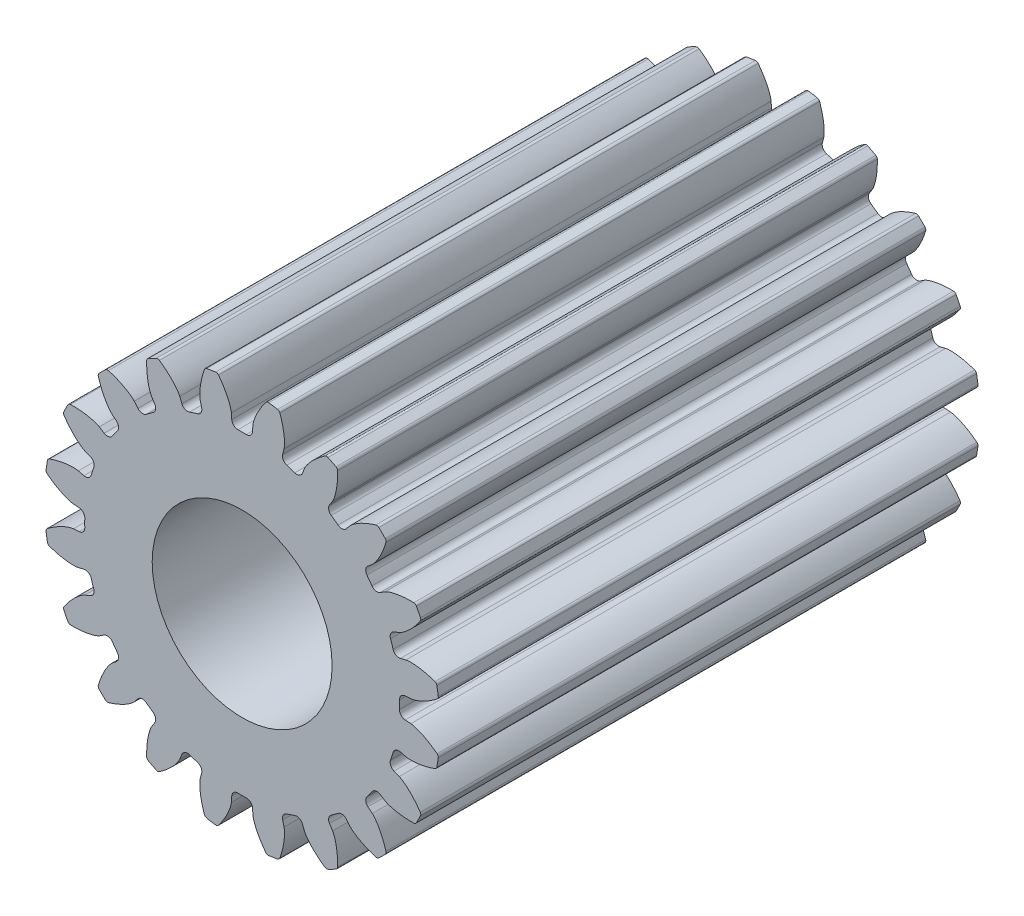
from build123d import *

# Parameters (mm, degrees)
SKETCH1_R                                 = 5.5
BOSS_EXTRUDE1_DEPTH                       = 15
CUT_EXTRUDE_DCLTBC_DEPTH                  = 17.896745249
FILLET_TIP_DCLTBC_R                       = 0.083876259
FILLET_ROOT_DCLTBC_R                      = 0.167752518
CIRPATTERN_DCLTBC_COUNT                   = 20
FILLET_TIP_DCLTBC_OF_CIRPATTERN_DCLTBC_R  = 0.083876259
FILLET_ROOT_DCLTBC_OF_CIRPATTERN_DCLTBC_R = 0.167752518
SKETCH4_R                                 = 2.5
CUT_EXTRUDE2_DEPTH                        = 17.865121555


with BuildPart() as part:
    # Sketch1 → Boss-Extrude1 (new body)
    with BuildSketch(Plane.XY):
        Circle(SKETCH1_R)
    extrude(amount=BOSS_EXTRUDE1_DEPTH)

    # DCLTBC → Cut-Extrude-DCLTBC (cut, through all)
    with BuildSketch(Plane.XY):
        with BuildLine():
            Line((-0.298786982, 4.688953175), (-0.278217156, 4.366144777))
            ThreePointArc((-0.278217156, 4.366144777), (0, 4.375), (0.278217156, 4.366144777))
            Line((0.278217156, 4.366144777), (0.298786982, 4.688953175))
            add(Edge.make_bspline(
                [(0.298786982, 4.688953175), (0.298885303, 4.690235768), (0.299212216, 4.693829281), (0.300032178, 4.700607016), (0.301656509, 4.711638976), (0.304146629, 4.725650974), (0.307847067, 4.743703274), (0.312824999, 4.764886928), (0.318942425, 4.788072131), (0.32629422, 4.813184764), (0.334243016, 4.838132069), (0.342742582, 4.862912541), (0.351722862, 4.887497966), (0.363205633, 4.917153446), (0.377814175, 4.952534177), (0.396106934, 4.993608657), (0.418286495, 5.039847917), (0.442414202, 5.086578132), (0.467404569, 5.132227021), (0.49407968, 5.177940439), (0.520898914, 5.221879282), (0.55020334, 5.267070018), (0.577990149, 5.308557313), (0.610710065, 5.354514358), (0.637580398, 5.391451415), (0.666652735, 5.429152384), (0.680996035, 5.447433719), (0.688407727, 5.45674764)],
                knots=[0, 0, 0, 0, 0, 0.005376749, 0.015083688, 0.02853182, 0.04661014, 0.064854849, 0.092110526, 0.119476176, 0.146842496, 0.174208854, 0.201574956, 0.228941013, 0.256307345, 0.307035032, 0.361767352, 0.416499661, 0.471231937, 0.525964282, 0.580696616, 0.635428982, 0.690161387, 0.744893688, 0.799626082, 0.854358407, 0.909090915, 0.909090915, 0.909090915, 0.909090915, 0.909090915], degree=4))
            ThreePointArc((0.688407727, 5.45674764), (0, 5.5), (-0.688407727, 5.45674764))
            add(Edge.make_bspline(
                [(-0.298786982, 4.688953175), (-0.298885303, 4.690235768), (-0.299212216, 4.693829281), (-0.300032178, 4.700607016), (-0.301656509, 4.711638976), (-0.304146629, 4.725650974), (-0.307847067, 4.743703274), (-0.312824999, 4.764886928), (-0.318942425, 4.788072131), (-0.32629422, 4.813184764), (-0.334243016, 4.838132069), (-0.342742582, 4.862912541), (-0.351722862, 4.887497966), (-0.363205633, 4.917153446), (-0.377814175, 4.952534177), (-0.396106934, 4.993608657), (-0.418286495, 5.039847917), (-0.442414202, 5.086578132), (-0.467404569, 5.132227021), (-0.49407968, 5.177940439), (-0.520898914, 5.221879282), (-0.55020334, 5.267070018), (-0.577990149, 5.308557313), (-0.610710065, 5.354514358), (-0.637580398, 5.391451415), (-0.666652735, 5.429152384), (-0.680996035, 5.447433719), (-0.688407727, 5.45674764)],
                knots=[0, 0, 0, 0, 0, 0.005376749, 0.015083688, 0.02853182, 0.04661014, 0.064854849, 0.092110526, 0.119476176, 0.146842496, 0.174208854, 0.201574956, 0.228941013, 0.256307345, 0.307035032, 0.361767352, 0.416499661, 0.471231937, 0.525964282, 0.580696616, 0.635428982, 0.690161387, 0.744893688, 0.799626082, 0.854358407, 0.909090915, 0.909090915, 0.909090915, 0.909090915, 0.909090915], degree=4))
        make_face()
    cut_extrude_dcltbc = extrude(amount=CUT_EXTRUDE_DCLTBC_DEPTH, mode=Mode.SUBTRACT)

    # Fillet-Tip-DCLTBC
    fillet_tip_dcltbc_edges = [part.edges().sort_by_distance(p)[0] for p in [
        (0.688407727, 5.45674764, 7.5),
        (-0.688407727, 5.45674764, 7.5),
    ]]
    fillet(fillet_tip_dcltbc_edges, radius=FILLET_TIP_DCLTBC_R)

    # Fillet-Root-DCLTBC
    fillet_root_dcltbc_edges = [part.edges().sort_by_distance(p)[0] for p in [
        (0.278217156, 4.366144777, 7.5),
        (-0.278217156, 4.366144777, 7.5),
    ]]
    fillet(fillet_root_dcltbc_edges, radius=FILLET_ROOT_DCLTBC_R)

    # CirPattern-DCLTBC: Cut-Extrude-DCLTBC ×20 about axis
    cirpattern_dcltbc_axis = Axis((0, 0, 15), (0, 0, 1))
    for i in range(1, CIRPATTERN_DCLTBC_COUNT):
        add(cut_extrude_dcltbc.rotate(cirpattern_dcltbc_axis, i * 360 / CIRPATTERN_DCLTBC_COUNT), mode=Mode.SUBTRACT)

    # Fillet-Tip-DCLTBC of CirPattern-DCLTBC
    fillet_tip_dcltbc_of_cirpattern_dcltbc_edges = [part.edges().sort_by_distance(p)[0] for p in [
        (-1.0315131, 5.402405087, 7.5),
        (-2.340942409, 4.976945714, 7.5),
        (-2.650462238, 4.819237484, 7.5),
        (-3.764329338, 4.009965665, 7.5),
        (-4.009965665, 3.764329338, 7.5),
        (-4.819237484, 2.650462238, 7.5),
        (-4.976945714, 2.340942409, 7.5),
        (-5.402405087, 1.0315131, 7.5),
        (-5.45674764, 0.688407727, 7.5),
        (-5.45674764, -0.688407727, 7.5),
        (-5.402405087, -1.0315131, 7.5),
        (-4.976945714, -2.340942409, 7.5),
        (-4.819237484, -2.650462238, 7.5),
        (-4.009965665, -3.764329338, 7.5),
        (-3.764329338, -4.009965665, 7.5),
        (-2.650462238, -4.819237484, 7.5),
        (-2.340942409, -4.976945714, 7.5),
        (-1.0315131, -5.402405087, 7.5),
        (-0.688407727, -5.45674764, 7.5),
        (0.688407727, -5.45674764, 7.5),
        (1.0315131, -5.402405087, 7.5),
        (2.340942409, -4.976945714, 7.5),
        (2.650462238, -4.819237484, 7.5),
        (3.764329338, -4.009965665, 7.5),
        (4.009965665, -3.764329338, 7.5),
        (4.819237484, -2.650462238, 7.5),
        (4.976945714, -2.340942409, 7.5),
        (5.402405087, -1.0315131, 7.5),
        (5.45674764, -0.688407727, 7.5),
        (5.45674764, 0.688407727, 7.5),
        (5.402405087, 1.0315131, 7.5),
        (4.976945714, 2.340942409, 7.5),
        (4.819237484, 2.650462238, 7.5),
        (4.009965665, 3.764329338, 7.5),
        (3.764329338, 4.009965665, 7.5),
        (2.650462238, 4.819237484, 7.5),
        (2.340942409, 4.976945714, 7.5),
        (1.0315131, 5.402405087, 7.5),
    ]]
    fillet(fillet_tip_dcltbc_of_cirpattern_dcltbc_edges, radius=FILLET_TIP_DCLTBC_OF_CIRPATTERN_DCLTBC_R)

    # Fillet-Root-DCLTBC of CirPattern-DCLTBC
    fillet_root_dcltbc_of_cirpattern_dcltbc_edges = [part.edges().sort_by_distance(p)[0] for p in [
        (-1.084612696, 4.238424271, 7.5),
        (-1.613813176, 4.066476612, 7.5),
        (-2.341273102, 3.695817266, 7.5),
        (-2.791437917, 3.368753383, 7.5),
        (-3.368753383, 2.791437917, 7.5),
        (-3.695817266, 2.341273102, 7.5),
        (-4.066476612, 1.613813176, 7.5),
        (-4.238424271, 1.084612696, 7.5),
        (-4.366144777, 0.278217156, 7.5),
        (-4.366144777, -0.278217156, 7.5),
        (-4.238424271, -1.084612696, 7.5),
        (-4.066476612, -1.613813176, 7.5),
        (-3.695817266, -2.341273102, 7.5),
        (-3.368753383, -2.791437917, 7.5),
        (-2.791437917, -3.368753383, 7.5),
        (-2.341273102, -3.695817266, 7.5),
        (-1.613813176, -4.066476612, 7.5),
        (-1.084612696, -4.238424271, 7.5),
        (-0.278217156, -4.366144777, 7.5),
        (0.278217156, -4.366144777, 7.5),
        (1.084612696, -4.238424271, 7.5),
        (1.613813176, -4.066476612, 7.5),
        (2.341273102, -3.695817266, 7.5),
        (2.791437917, -3.368753383, 7.5),
        (3.368753383, -2.791437917, 7.5),
        (3.695817266, -2.341273102, 7.5),
        (4.066476612, -1.613813176, 7.5),
        (4.238424271, -1.084612696, 7.5),
        (4.366144777, -0.278217156, 7.5),
        (4.366144777, 0.278217156, 7.5),
        (4.238424271, 1.084612696, 7.5),
        (4.066476612, 1.613813176, 7.5),
        (3.695817266, 2.341273102, 7.5),
        (3.368753383, 2.791437917, 7.5),
        (2.791437917, 3.368753383, 7.5),
        (2.341273102, 3.695817266, 7.5),
        (1.613813176, 4.066476612, 7.5),
        (1.084612696, 4.238424271, 7.5),
    ]]
    fillet(fillet_root_dcltbc_of_cirpattern_dcltbc_edges, radius=FILLET_ROOT_DCLTBC_OF_CIRPATTERN_DCLTBC_R)

    # Sketch4 → Cut-Extrude2 (cut, through all)
    with BuildSketch(Plane.XY.offset(15)):
        Circle(SKETCH4_R)
    extrude(amount=-CUT_EXTRUDE2_DEPTH, mode=Mode.SUBTRACT)


solid = part.part
